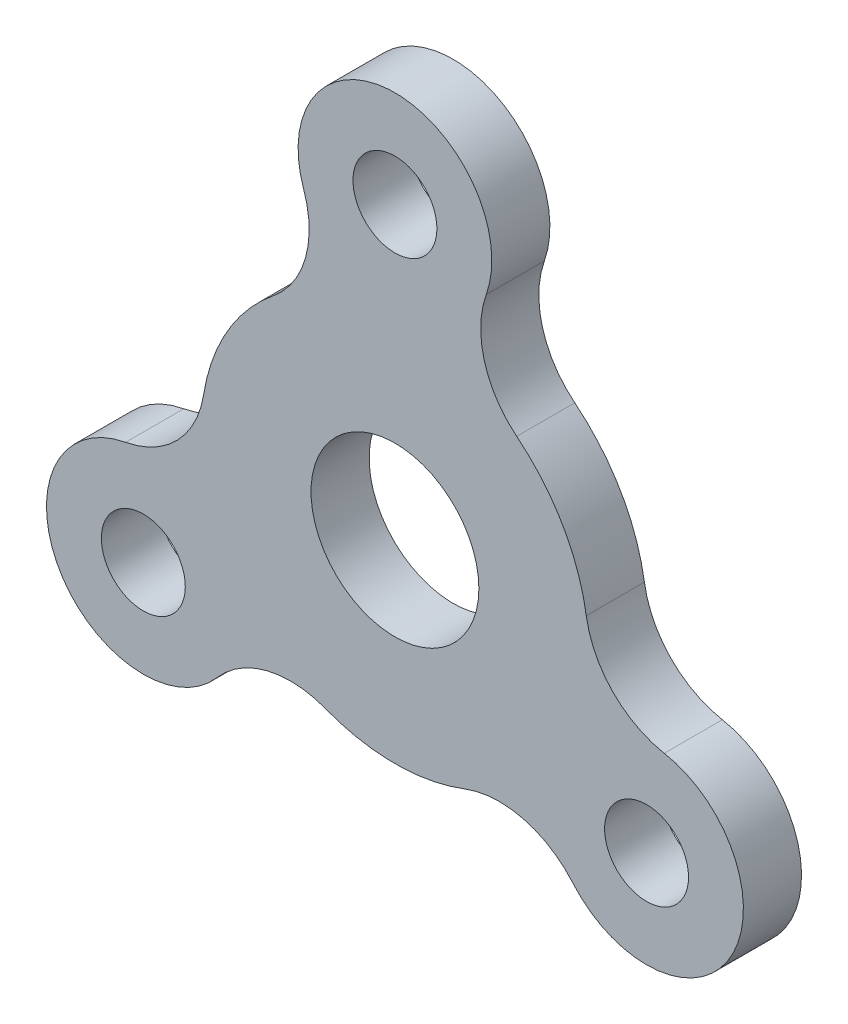
from build123d import *

# Parameters (mm, degrees)
BOSS_EXTRUDE1_DEPTH = 90
SKETCH2_R           = 65
CUT_EXTRUDE1_DEPTH  = 813.027357612
SKETCH3_R           = 130
CUT_EXTRUDE2_DEPTH  = 813.027357612


with BuildPart() as part:
    # Sketch1 → Boss-Extrude1 (new body)
    with BuildSketch(Plane.XY):
        with BuildLine():
            ThreePointArc((-188.561808316, 233.333333333), (-259.807621135, 150), (-296.353498375, 46.632649519))
            ThreePointArc((-296.353498375, 46.632649519), (-337.006124854, -34.638611198), (-417.120839632, -77.525512861))
            ThreePointArc((-417.120839632, -77.525512861), (-519.615242271, -300), (-275.699483395, -322.474487139))
            ThreePointArc((-275.699483395, -322.474487139), (-198.500979677, -274.536559755), (-107.791690058, -279.965982852))
            ThreePointArc((-107.791690058, -279.965982852), (0, -300), (107.791690058, -279.965982852))
            ThreePointArc((107.791690058, -279.965982852), (198.500979677, -274.536559755), (275.699483395, -322.474487139))
            ThreePointArc((275.699483395, -322.474487139), (519.615242271, -300), (417.120839632, -77.525512861))
            ThreePointArc((417.120839632, -77.525512861), (337.006124854, -34.638611198), (296.353498375, 46.632649519))
            ThreePointArc((296.353498375, 46.632649519), (259.807621135, 150), (188.561808316, 233.333333333))
            ThreePointArc((188.561808316, 233.333333333), (138.505145177, 309.175170954), (141.421356237, 400))
            ThreePointArc((141.421356237, 400), (0, 600), (-141.421356237, 400))
            ThreePointArc((-141.421356237, 400), (-138.505145177, 309.175170954), (-188.561808316, 233.333333333))
        make_face()
    extrude(amount=BOSS_EXTRUDE1_DEPTH)

    # Sketch2 → Cut-Extrude1 (cut, through all)
    with BuildSketch(Plane.XY.offset(90)):
        with Locations((0, 450)):
            Circle(SKETCH2_R)
        with Locations((-389.711431703, -225)):
            Circle(SKETCH2_R)
        with Locations((389.711431703, -225)):
            Circle(SKETCH2_R)
    extrude(amount=-CUT_EXTRUDE1_DEPTH, mode=Mode.SUBTRACT)

    # Sketch3 → Cut-Extrude2 (cut, through all)
    with BuildSketch(Plane.XY.offset(90)):
        Circle(SKETCH3_R)
    extrude(amount=-CUT_EXTRUDE2_DEPTH, mode=Mode.SUBTRACT)


solid = part.part
